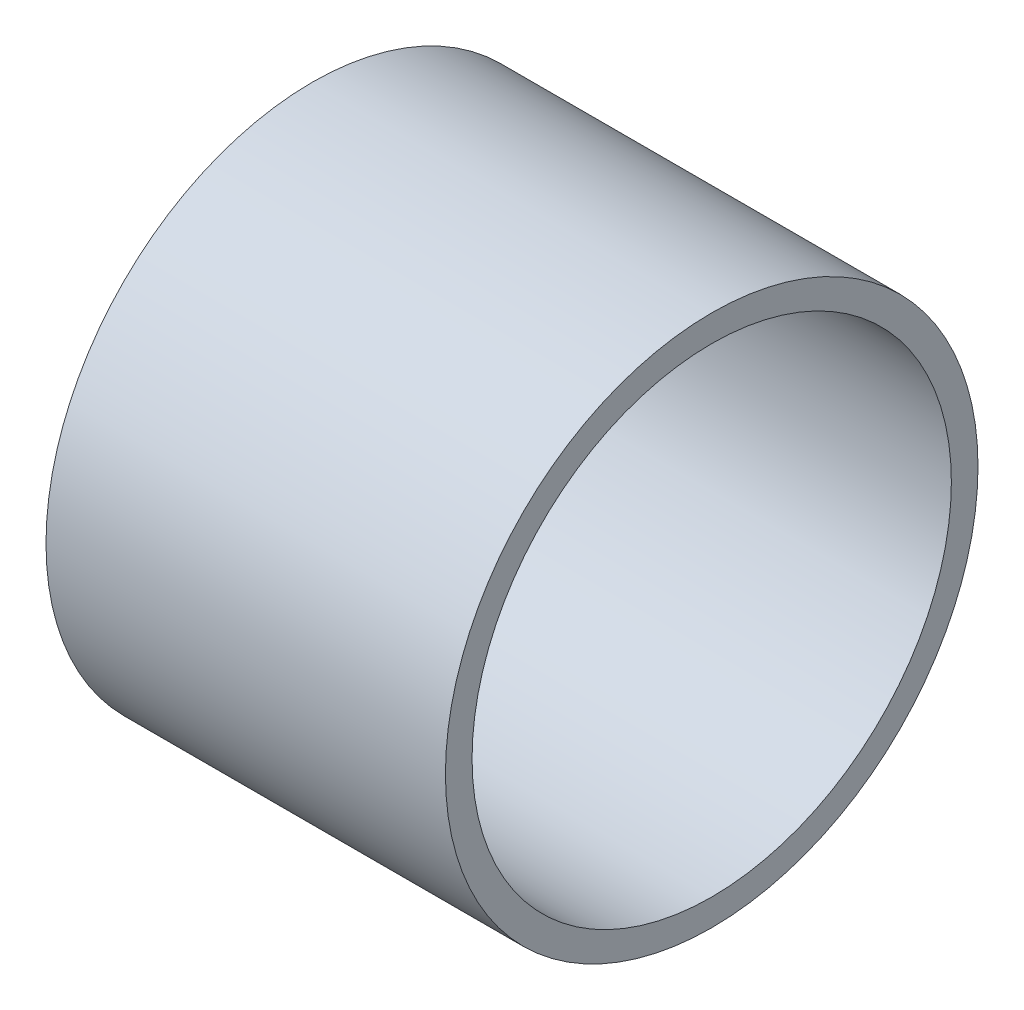
from build123d import *

# Parameters (mm, degrees)
ESQUISSE1_W = 60
ESQUISSE1_H = 4


with BuildPart() as part:
    # Esquisse1 → Révolution1 (revolve)
    with BuildSketch(Plane(origin=(0, 0, 0), x_dir=(-1, 0, 0), z_dir=(0, 0, -1)), mode=Mode.PRIVATE) as r_volution1_sk:
        with Locations((-30, 38)):
            Rectangle(ESQUISSE1_W, ESQUISSE1_H)
    revolve(r_volution1_sk.sketch.rotate(Axis((60, 0, 0), (-1, 0, 0)), 270), axis=Axis((60, 0, 0), (-1, 0, 0)))


solid = part.part
